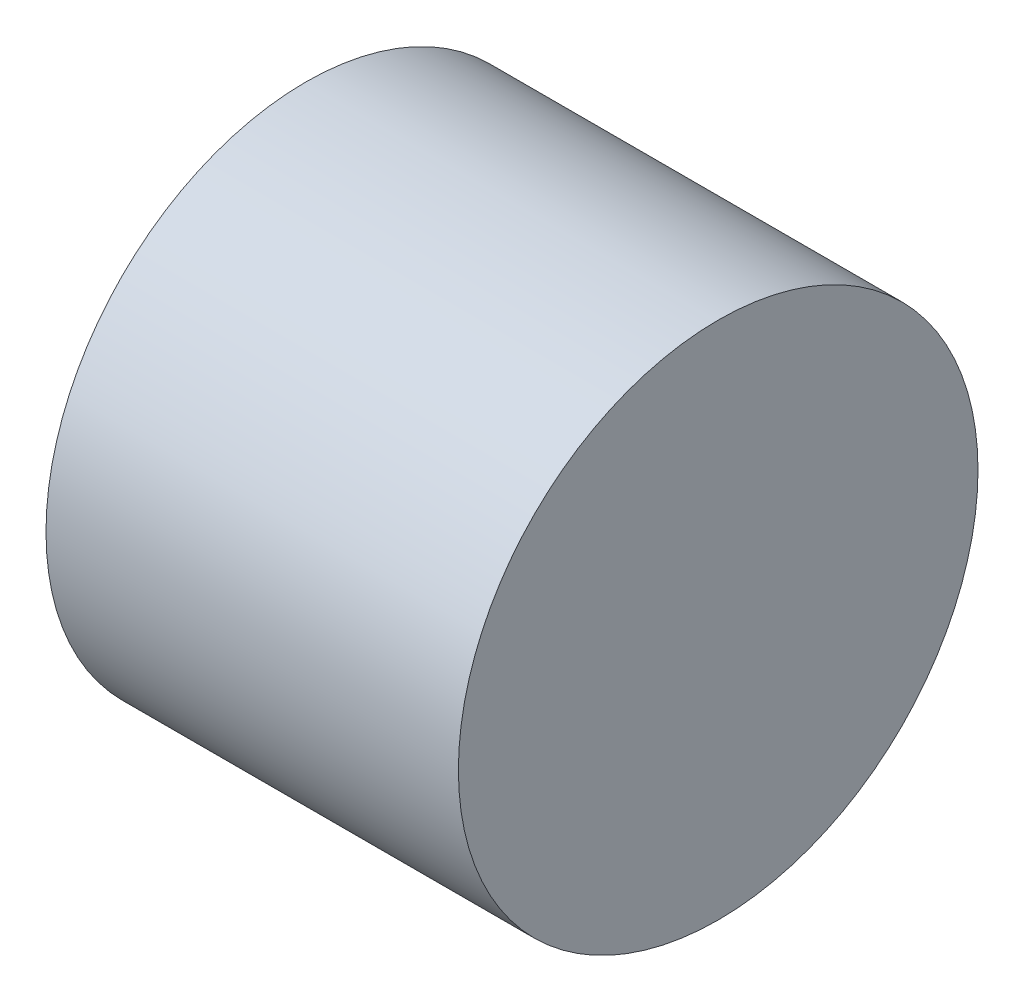
from build123d import *

# Parameters (mm, degrees)
SKETCH1_R           = 31.5
BOSS_EXTRUDE1_DEPTH = 25


with BuildPart() as part:
    # Sketch1 → Boss-Extrude1 (new, symmetric)
    with BuildSketch(Plane(origin=(0, 0, 0), x_dir=(0, 0, -1), z_dir=(1, 0, 0))):
        Circle(SKETCH1_R)
    extrude(amount=BOSS_EXTRUDE1_DEPTH, both=True)


solid = part.part
